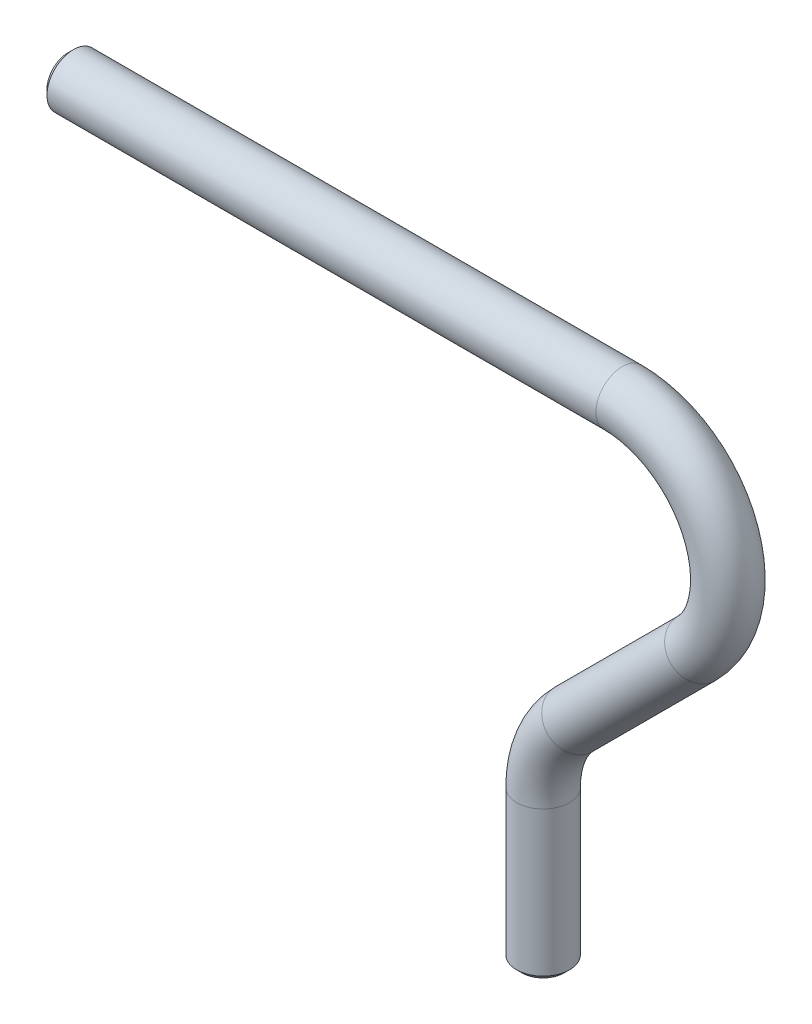
from build123d import *

# Parameters (mm, degrees)
SKETCH_2_R     = 5
SKETCH_2_R_2   = 3
CHAMFER_1_SIZE = 1


with BuildPart() as part:
    # По траектории1: sweep along a path in Эскиз1
    with BuildLine(Plane.XY) as sweep_1_path:
        Line((0, 0), (105, 0))
        ThreePointArc((105, 0), (123.47759065, -12.346331353), (119.142135624, -34.142135624))
        Line((119.142135624, -34.142135624), (95.857864376, -57.426406871))
        ThreePointArc((95.857864376, -57.426406871), (91.52240935, -63.914873848), (90, -71.568542495))
        Line((90, -71.568542495), (90, -100))
    # Эскиз2 → По траектории1 (sweep)
    with BuildSketch(Plane(origin=(0, 0, 0), x_dir=(0, 0, -1), z_dir=(1, 0, 0))):
        Circle(SKETCH_2_R)
        Circle(SKETCH_2_R_2, mode=Mode.SUBTRACT)
    sweep(path=sweep_1_path.line)

    # Фаска1
    chamfer_1_edges = [part.edges().sort_by_distance(p)[0] for p in [
        (90, -100, 5),
        (0, 0, 5),
    ]]
    chamfer(chamfer_1_edges, length=CHAMFER_1_SIZE)


solid = part.part
